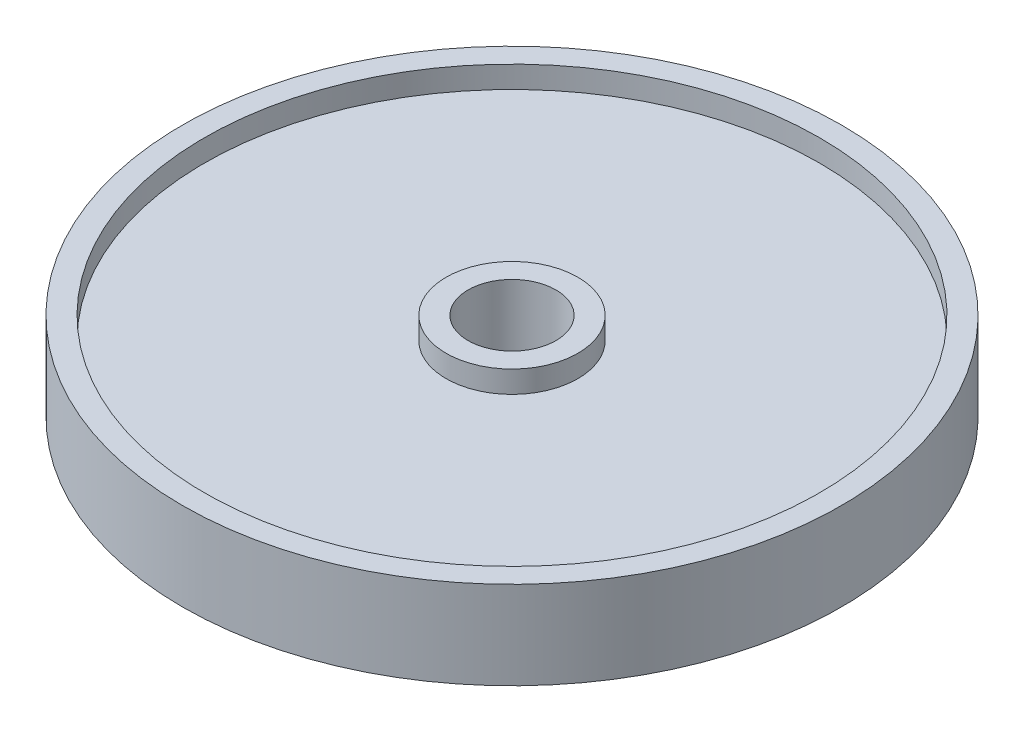
from build123d import *


with BuildPart() as part:
    # Sketch1 → Revolve1 (revolve)
    with BuildSketch(Plane.XY, mode=Mode.PRIVATE) as revolve1_sk:
        Polygon((5, 5), (7.5, 5), (7.5, 2.5), (35, 2.5), (35, 5), (37.5, 5), (37.5, -5), (35, -5), (35, -2.5), (7.5, -2.5), (7.5, -5), (5, -5), align=None)
    revolve(revolve1_sk.sketch.rotate(Axis((0, -9.482225896, 0), (0, 1, 0)), 90), axis=Axis((0, -9.482225896, 0), (0, 1, 0)))


solid = part.part
